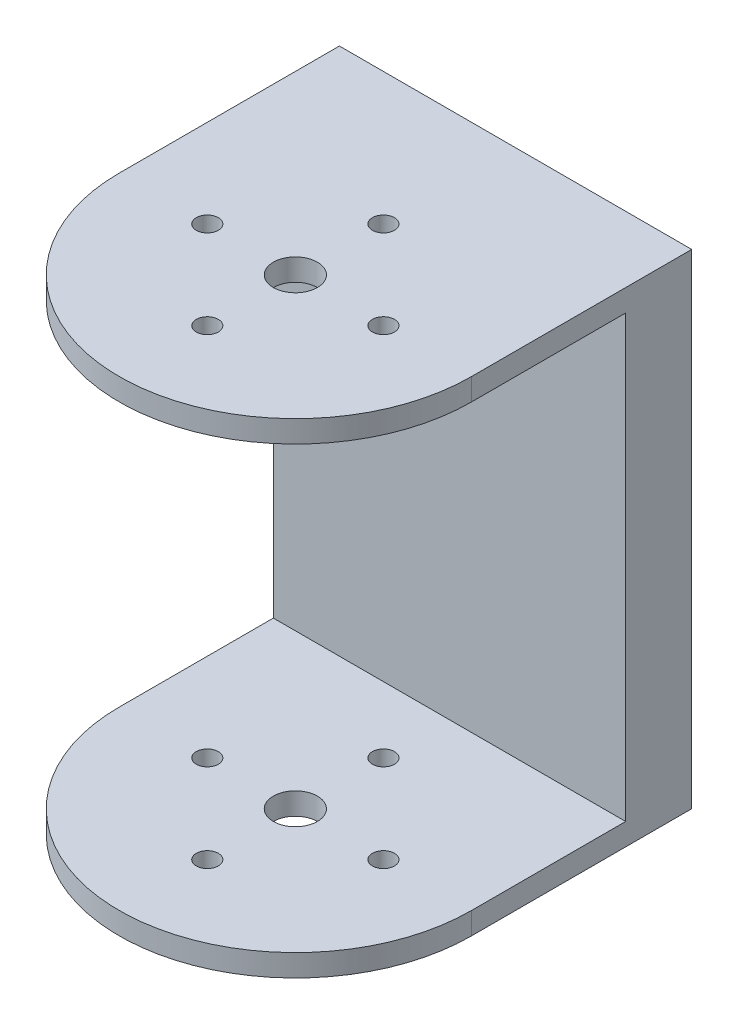
from build123d import *

# Parameters (mm, degrees)
SKETCH1_R           = 1
SKETCH1_R_2         = 2
BOSS_EXTRUDE1_DEPTH = 44
SKETCH2_W           = 30
SKETCH2_H           = 40
CUT_EXTRUDE1_DEPTH  = 58.965506985


with BuildPart() as part:
    # Sketch1 → Boss-Extrude1 (new body)
    with BuildSketch(Plane(origin=(0, 0, 0), x_dir=(1, 0, 0), z_dir=(0, 1, 0))):
        with BuildLine():
            Line((-16, 0), (-16, 20))
            Line((-16, 20), (16, 20))
            Line((16, 20), (16, 0))
            ThreePointArc((16, 0), (0, -16), (-16, 0))
        make_face()
        with Locations(Location((0, 8, 0), (0, 0, 270))):
            Circle(SKETCH1_R, mode=Mode.SUBTRACT)
        with Locations(Location((8, 0, 0), (0, 0, 270))):
            Circle(SKETCH1_R, mode=Mode.SUBTRACT)
        with Locations(Location((0, -8, 0), (0, 0, 270))):
            Circle(SKETCH1_R, mode=Mode.SUBTRACT)
        with Locations(Location((-8, 0, 0), (0, 0, 270))):
            Circle(SKETCH1_R, mode=Mode.SUBTRACT)
        with Locations(Location((0, 0, 0), (0, 0, 270))):
            Circle(SKETCH1_R_2, mode=Mode.SUBTRACT)
    extrude(amount=BOSS_EXTRUDE1_DEPTH)

    # Sketch2 → Cut-Extrude1 (cut, through all)
    with BuildSketch(Plane(origin=(16, 0, 0), x_dir=(0, 0, -1), z_dir=(1, 0, 0))):
        with Locations((-1, 22)):
            Rectangle(SKETCH2_W, SKETCH2_H)
    extrude(amount=-CUT_EXTRUDE1_DEPTH, mode=Mode.SUBTRACT)


solid = part.part
